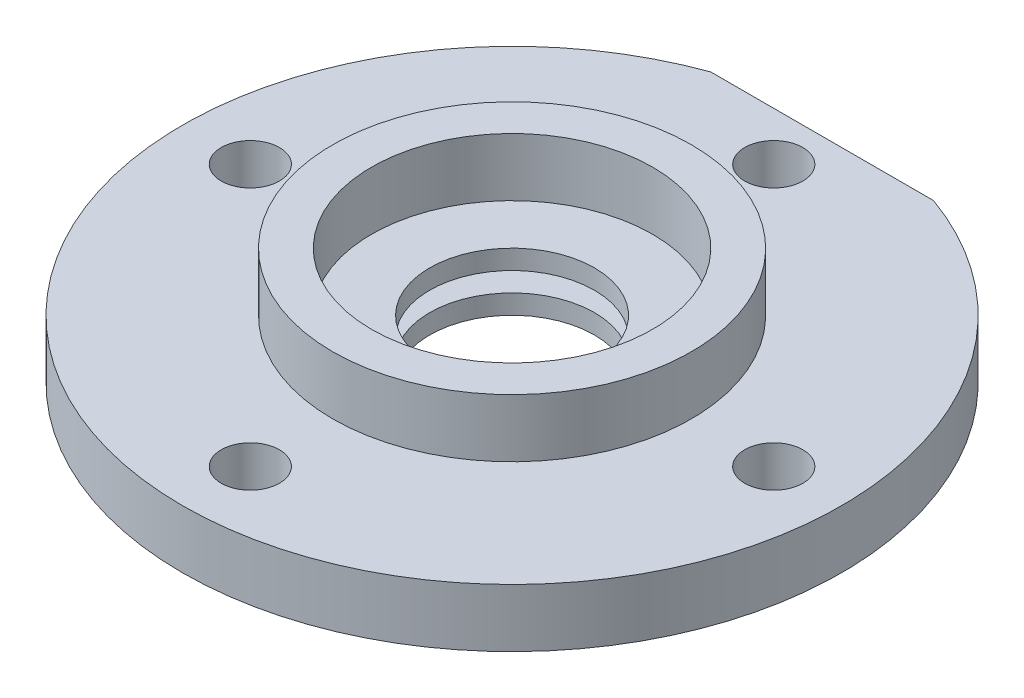
from build123d import *

# Parameters (mm, degrees)
SKETCH_1_R      = 3
EXTRUDE_1_DEPTH = 6
SKETCH_2_R      = 18.5
EXTRUDE_2_DEPTH = 6


with BuildPart() as part:
    # 草图1 → 凸台-拉伸1 (new body)
    with BuildSketch(Plane(origin=(0, 0, 0), x_dir=(1, 0, 0), z_dir=(0, 1, 0))):
        with BuildLine():
            Line((-11.489125293, 32), (11.489125293, 32))
            ThreePointArc((11.489125293, 32), (0, -34), (-11.489125293, 32))
        make_face()
        with Locations(Location((0, 27, 0), (0, 0, 270))):
            Circle(SKETCH_1_R, mode=Mode.SUBTRACT)
        with Locations(Location((27, 0, 0), (0, 0, 270))):
            Circle(SKETCH_1_R, mode=Mode.SUBTRACT)
        with Locations(Location((0, -27, 0), (0, 0, 270))):
            Circle(SKETCH_1_R, mode=Mode.SUBTRACT)
        with Locations(Location((-27, 0, 0), (0, 0, 270))):
            Circle(SKETCH_1_R, mode=Mode.SUBTRACT)
    extrude(amount=EXTRUDE_1_DEPTH)

    # 草图2 → 凸台-拉伸2 (add)
    with BuildSketch(Plane(origin=(0, 6, 0), x_dir=(1, 0, 0), z_dir=(0, 1, 0))):
        with Locations(Location((0, 0, 0), (0, 0, 270))):
            Circle(SKETCH_2_R)
    extrude(amount=EXTRUDE_2_DEPTH)

    # 草图3 → 切除-旋转1 (revolve, cut)
    with BuildSketch(Plane.XY, mode=Mode.PRIVATE) as cut_revolve_1_sk:
        Polygon((0, 12), (14.5, 12), (14.5, 6), (8.5, 6), (8.5, 4), (12.5, 4), (12.5, 2), (8.5, 2), (8.5, 0), (0, 0), align=None)
    revolve(cut_revolve_1_sk.sketch.rotate(Axis((0, 0, 0), (0, 1, 0)), 90), axis=Axis((0, 0, 0), (0, 1, 0)), mode=Mode.SUBTRACT)


solid = part.part
